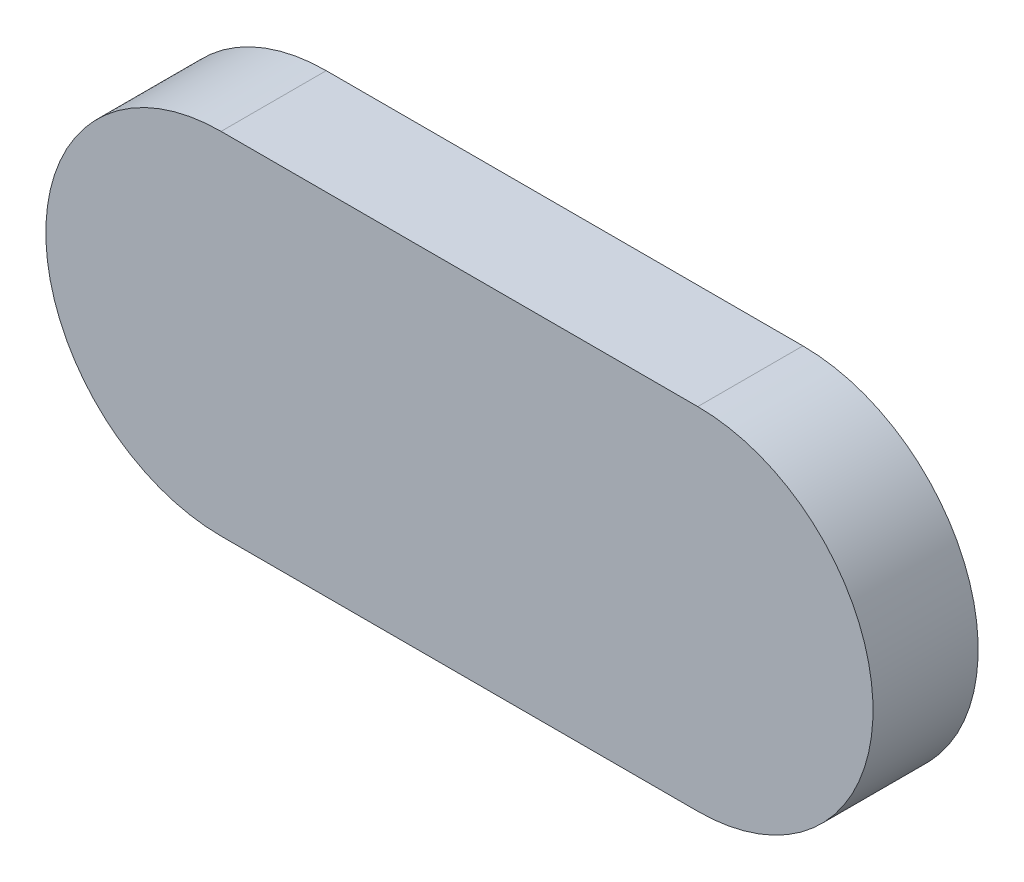
from build123d import *

# Parameters (mm, degrees)
SKETCH1_W           = 68
SKETCH1_H           = 50
BOSS_EXTRUDE1_DEPTH = 15


with BuildPart() as part:
    # Sketch1 → Boss-Extrude1 (new body)
    with BuildSketch(Plane.XY):
        Rectangle(SKETCH1_W, SKETCH1_H)
        with BuildLine():
            ThreePointArc((-34, -25), (-59, 0), (-34, 25))
            Line((-34, 25), (-34, -25))
        make_face()
        with BuildLine():
            ThreePointArc((34, 25), (59, 0), (34, -25))
            Line((34, -25), (34, 25))
        make_face()
    extrude(amount=BOSS_EXTRUDE1_DEPTH)


solid = part.part
